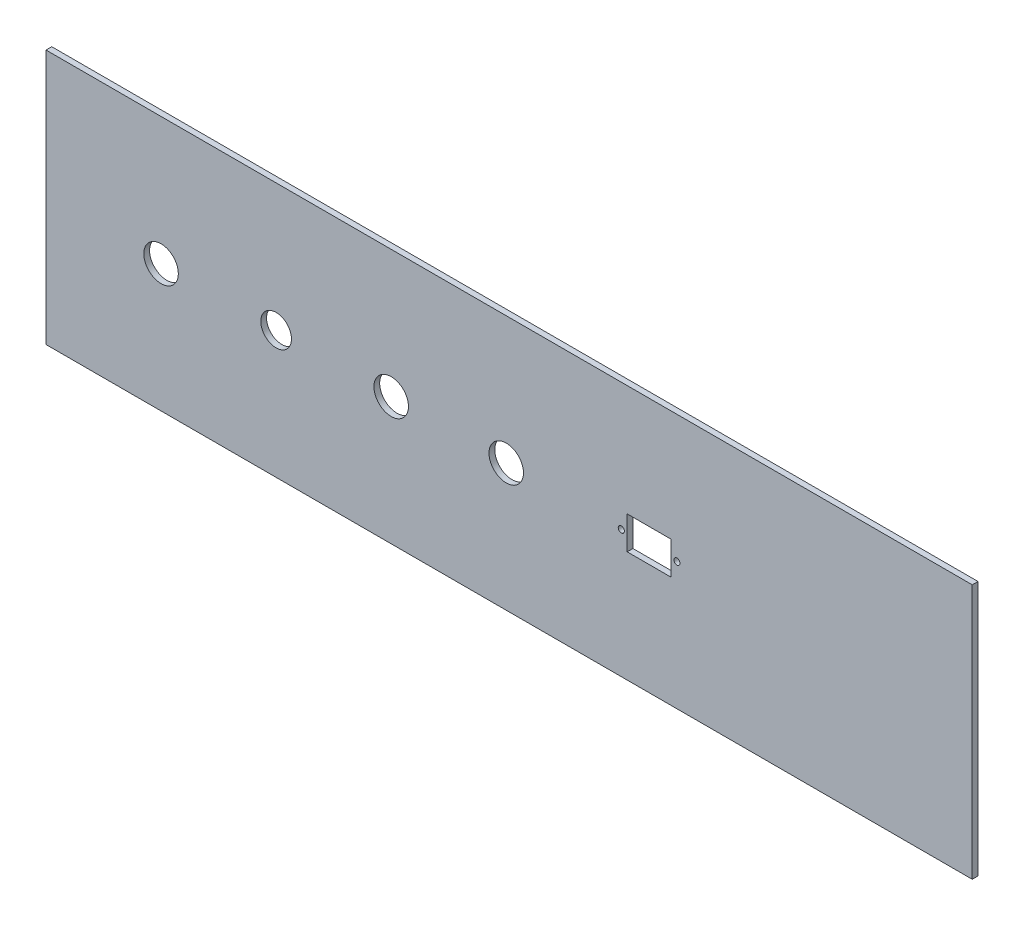
from build123d import *

# Parameters (mm, degrees)
ESQUISSE1_W        = 483
ESQUISSE1_H        = 133
ESQUISSE1_R        = 8
ESQUISSE1_R_2      = 9
ESQUISSE1_R_3      = 1.6
ESQUISSE1_W_2      = 22.86
ESQUISSE1_H_2      = 17.15
BOSS_EXTRU_1_DEPTH = 3


with BuildPart() as part:
    # Esquisse1 → Boss.-Extru.1 (new body)
    with BuildSketch(Plane.XY):
        with Locations((-170.219987768, 53.130045872)):
            Rectangle(ESQUISSE1_W, ESQUISSE1_H)
        with Locations((-291.719987768, 53.130045872)):
            Circle(ESQUISSE1_R, mode=Mode.SUBTRACT)
        with Locations((-351.719987768, 53.130045872)):
            Circle(ESQUISSE1_R_2, mode=Mode.SUBTRACT)
        with Locations((-231.719987768, 53.130045872)):
            Circle(ESQUISSE1_R_2, mode=Mode.SUBTRACT)
        with Locations((-171.719987768, 53.130045872)):
            Circle(ESQUISSE1_R_2, mode=Mode.SUBTRACT)
        with Locations((-111.719987768, 53.120045872)):
            Circle(ESQUISSE1_R_3, mode=Mode.SUBTRACT)
        with Locations((-82.719987768, 53.120045872)):
            Circle(ESQUISSE1_R_3, mode=Mode.SUBTRACT)
        with Locations((-97.219987768, 53.120045872)):
            Rectangle(ESQUISSE1_W_2, ESQUISSE1_H_2, mode=Mode.SUBTRACT)
    extrude(amount=BOSS_EXTRU_1_DEPTH)


solid = part.part
